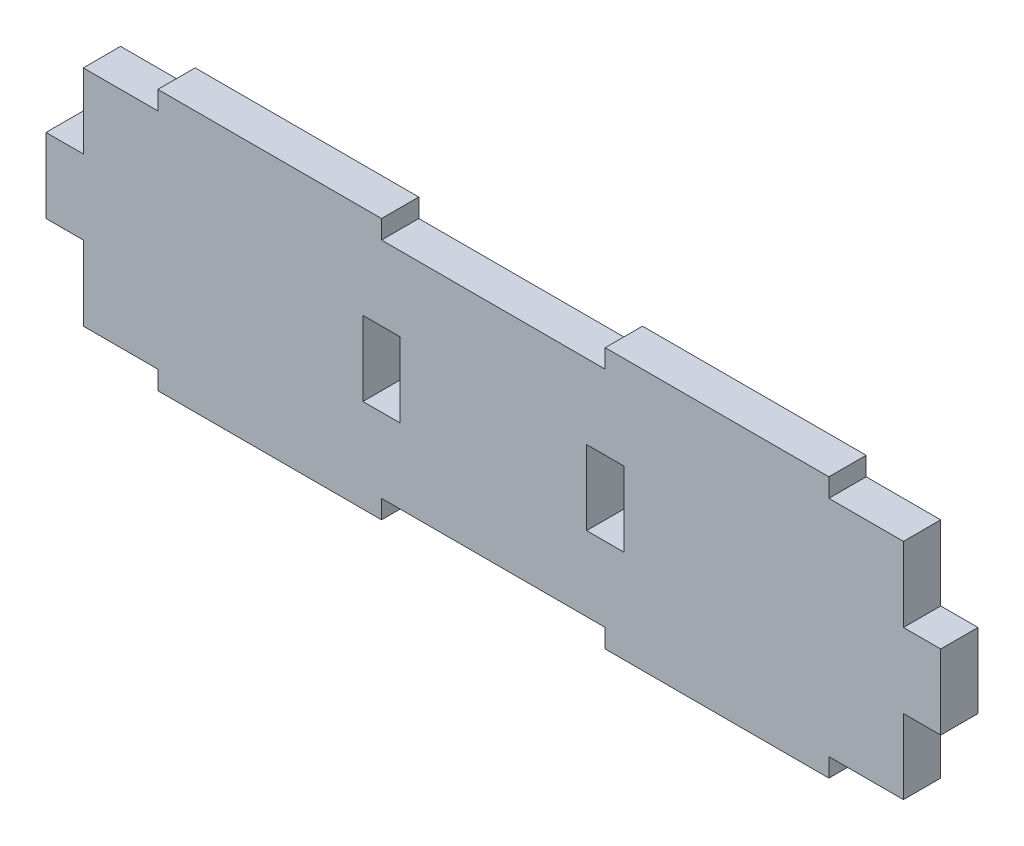
from build123d import *

# Parameters (mm, degrees)
SKETCH1_W           = 304.8
SKETCH1_H           = 76.2
BOSS_EXTRUDE1_DEPTH = 12.7
SKETCH2_W           = 76.2
SKETCH2_H           = 6.35
BOSS_EXTRUDE2_DEPTH = 12.7
SKETCH3_W           = 12.7
SKETCH3_H           = 25.4
CUT_EXTRUDE1_DEPTH  = 160.257189791


with BuildPart() as part:
    # Sketch1 → Boss-Extrude1 (new body)
    with BuildSketch(Plane.XY):
        Rectangle(SKETCH1_W, SKETCH1_H)
    extrude(amount=BOSS_EXTRUDE1_DEPTH)

    # Sketch2 → Boss-Extrude2 (add)
    with BuildSketch(Plane.XY.offset(12.7)):
        with Locations((-76.2, -41.275)):
            Rectangle(SKETCH2_W, SKETCH2_H)
        with Locations((76.2, -41.275)):
            Rectangle(SKETCH2_W, SKETCH2_H)
        with Locations((76.2, 41.275)):
            Rectangle(SKETCH2_W, SKETCH2_H)
        with Locations((-76.2, 41.275)):
            Rectangle(SKETCH2_W, SKETCH2_H)
    extrude(amount=-BOSS_EXTRUDE2_DEPTH)

    # Sketch3 → Cut-Extrude1 (cut, through all)
    with BuildSketch(Plane.XY.offset(12.7)):
        with Locations((-146.05, -25.4)):
            Rectangle(SKETCH3_W, SKETCH3_H)
        with Locations((-146.05, 25.4)):
            Rectangle(SKETCH3_W, SKETCH3_H)
        with Locations((146.05, 25.4)):
            Rectangle(SKETCH3_W, SKETCH3_H)
        with Locations((146.05, -25.4)):
            Rectangle(SKETCH3_W, SKETCH3_H)
        with Locations((38.1, 0)):
            Rectangle(SKETCH3_W, SKETCH3_H)
        with Locations((-38.1, 0)):
            Rectangle(SKETCH3_W, SKETCH3_H)
    extrude(amount=-CUT_EXTRUDE1_DEPTH, mode=Mode.SUBTRACT)


solid = part.part
